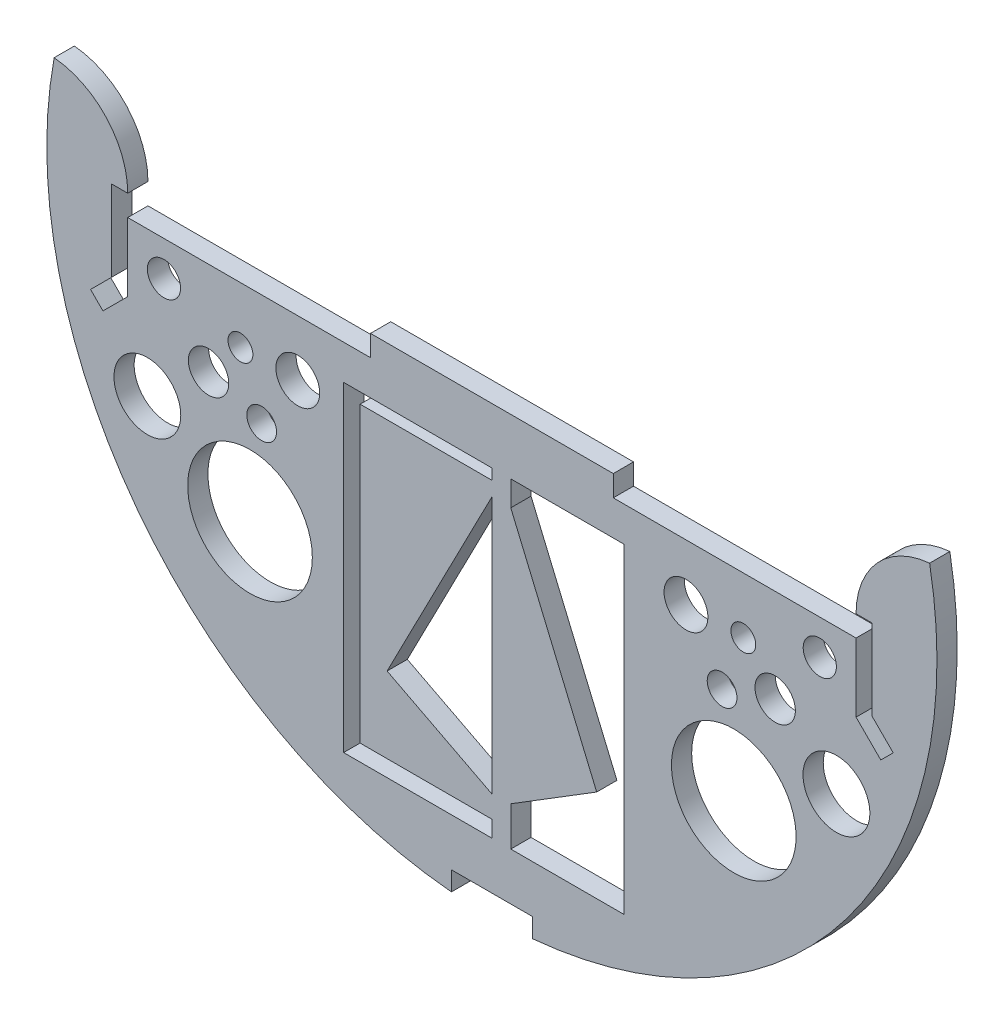
from build123d import *

# Parameters (mm, degrees)
SKETCH1_R           = 2.60777722
SKETCH1_R_2         = 5.242542832
SKETCH1_R_3         = 3.166937391
SKETCH1_R_4         = 9.783190039
SKETCH1_R_5         = 3.439146742
SKETCH1_R_6         = 2.333532814
SKETCH1_R_7         = 1.949356062
BOSS_EXTRUDE1_DEPTH = 3.175


with BuildPart() as part:
    # Sketch1 → Boss-Extrude1 (new body)
    with BuildSketch(Plane.XY):
        with BuildLine():
            Line((-57.15, 0), (-59.69, 0))
            Line((-59.69, 0), (-59.69, -12.7))
            Line((-59.69, -12.7), (-62.981786531, -15.991786531))
            Line((-62.981786531, -15.991786531), (-61.033522603, -17.940050458))
            Line((-61.033522603, -17.940050458), (-57.15, -14.056527855))
            Line((-57.15, -14.056527855), (-57.15, -3.302))
            Line((-57.15, -3.302), (-19.05, -3.302))
            Line((-19.05, -3.302), (-19.05, 0))
            Line((-19.05, 0), (19.05, 0))
            Line((19.05, 0), (19.05, -3.302))
            Line((19.05, -3.302), (57.15, -3.302))
            Line((57.15, -3.302), (57.15, -14.056527855))
            Line((57.15, -14.056527855), (61.033522603, -17.940050458))
            Line((61.033522603, -17.940050458), (62.981786531, -15.991786531))
            Line((62.981786531, -15.991786531), (59.69, -12.7))
            Line((59.69, -12.7), (59.69, 0))
            Line((59.69, 0), (57.15, 0))
            ThreePointArc((57.15, 0), (60.470428387, 8.562338253), (68.695454545, 12.647411782))
            ThreePointArc((68.695454545, 12.647411782), (69.560764803, 6.35), (69.85, 0))
            ThreePointArc((69.85, 0), (51.587643869, -47.092860393), (6.35, -69.560764803))
            Line((6.35, -69.560764803), (6.35, -66.548))
            Line((6.35, -66.548), (-6.35, -66.548))
            Line((-6.35, -66.548), (-6.35, -69.560764803))
            ThreePointArc((-6.35, -69.560764803), (-51.587643869, -47.092860393), (-69.85, 0))
            ThreePointArc((-69.85, 0), (-69.560764803, 6.35), (-68.695454545, 12.647411782))
            ThreePointArc((-68.695454545, 12.647411782), (-60.470428387, 8.562338253), (-57.15, 0))
        make_face()
        with Locations((-51.460707528, -8.761001901)):
            Circle(SKETCH1_R, mode=Mode.SUBTRACT)
        with Locations((-54.068484748, -26.026352242)):
            Circle(SKETCH1_R_2, mode=Mode.SUBTRACT)
        with Locations((-44.460109085, -17.940050458)):
            Circle(SKETCH1_R_3, mode=Mode.SUBTRACT)
        with Locations((-37.959553388, -35.027121669)):
            Circle(SKETCH1_R_4, mode=Mode.SUBTRACT)
        with Locations((-30.458912199, -12.107533279)):
            Circle(SKETCH1_R_5, mode=Mode.SUBTRACT)
        with Locations((-36.126063319, -20.78380941)):
            Circle(SKETCH1_R_6, mode=Mode.SUBTRACT)
        with Locations((-39.459681626, -12.107533279)):
            Circle(SKETCH1_R_7, mode=Mode.SUBTRACT)
        with Locations(Location((37.959553388, -35.027121669, 0), (0, 0, 180))):
            Circle(SKETCH1_R_4, mode=Mode.SUBTRACT)
        with Locations(Location((36.126063319, -20.78380941, 0), (0, 0, 180))):
            Circle(SKETCH1_R_6, mode=Mode.SUBTRACT)
        with Locations(Location((30.458912199, -12.107533279, 0), (0, 0, 180))):
            Circle(SKETCH1_R_5, mode=Mode.SUBTRACT)
        with Locations(Location((39.459681626, -12.107533279, 0), (0, 0, 180))):
            Circle(SKETCH1_R_7, mode=Mode.SUBTRACT)
        with Locations(Location((44.460109085, -17.940050458, 0), (0, 0, 180))):
            Circle(SKETCH1_R_3, mode=Mode.SUBTRACT)
        with Locations(Location((54.068484748, -26.026352242, 0), (0, 0, 180))):
            Circle(SKETCH1_R_2, mode=Mode.SUBTRACT)
        with Locations(Location((51.460707528, -8.761001901, 0), (0, 0, 180))):
            Circle(SKETCH1_R, mode=Mode.SUBTRACT)
        Polygon((0, -12.7), (-16.44651858, -44.588157329), (0, -53.07055318), align=None, mode=Mode.SUBTRACT)
        Polygon((16.44651858, -44.588157329), (2.965479923, -52.923865877), (2.965479923, -59.078158296), (20.758668378, -59.078158296), (20.758668378, -8.761001901), (2.965479923, -8.761001901), (2.965479923, -12.7), align=None, mode=Mode.SUBTRACT)
        Polygon((0, -59.078158296), (-23.268802527, -59.078158296), (-23.268802527, -12.107533279), (-23.268802527, -8.761001901), (0, -8.761001901), (0, -10.43426759), (-20.676383037, -10.43426759), (-20.676383037, -56.497278023), (0, -56.497278023), align=None, mode=Mode.SUBTRACT)
    extrude(amount=BOSS_EXTRUDE1_DEPTH)


solid = part.part
